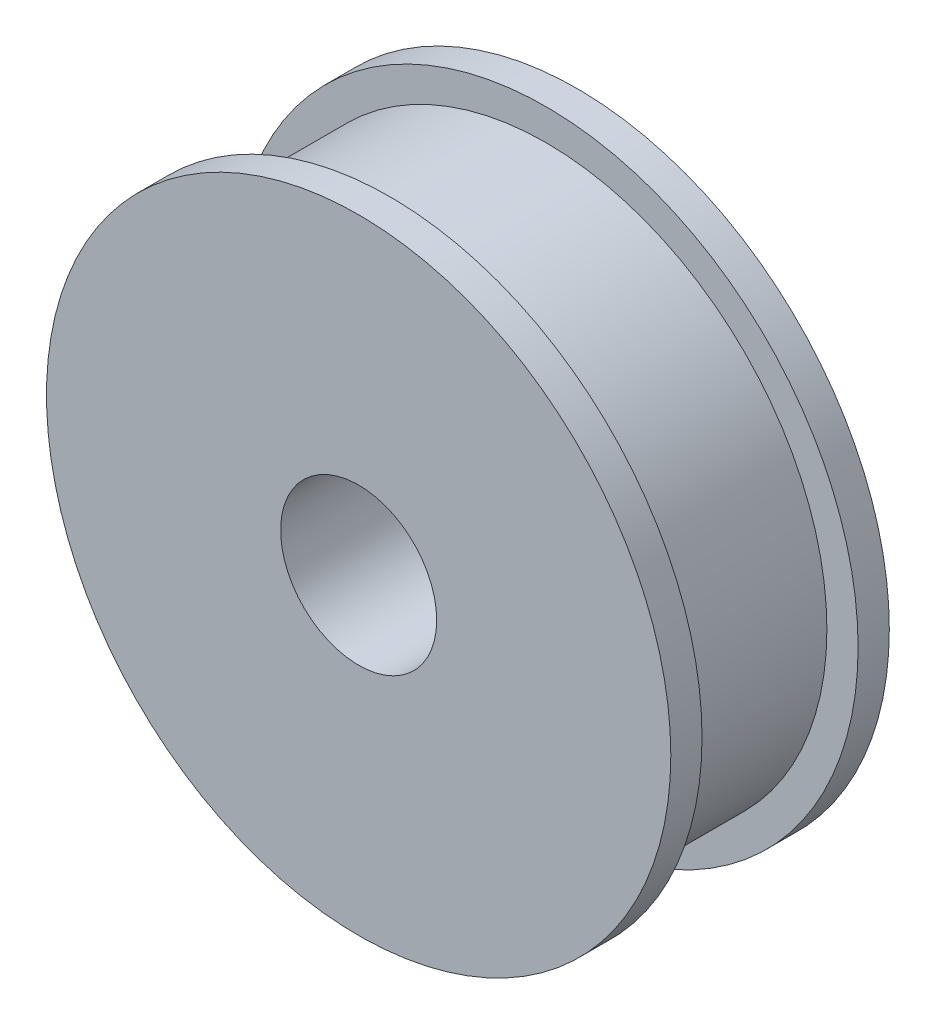
from build123d import *

# Parameters (mm, degrees)
SKETCH_2_R          = 20
EXTRUDE_1_DEPTH     = 2
SKETCH_3_R          = 18
EXTRUDE_2_DEPTH     = 10
SKETCH_4_R          = 20
EXTRUDE_3_DEPTH     = 2
SKETCH_5_R          = 5
CUT_EXTRUDE_1_DEPTH = 32.559467676


with BuildPart() as part:
    # ｽｹｯﾁ2 → ﾎﾞｽ - 押し出し1 (new body)
    with BuildSketch(Plane.XY):
        Circle(SKETCH_2_R)
    extrude(amount=EXTRUDE_1_DEPTH)

    # ｽｹｯﾁ3 → ﾎﾞｽ - 押し出し2 (add)
    with BuildSketch(Plane.XY.offset(2)):
        Circle(SKETCH_3_R)
    extrude(amount=EXTRUDE_2_DEPTH)

    # ｽｹｯﾁ4 → ﾎﾞｽ - 押し出し3 (add)
    with BuildSketch(Plane.XY.offset(12)):
        Circle(SKETCH_4_R)
    extrude(amount=EXTRUDE_3_DEPTH)

    # ｽｹｯﾁ5 → ｶｯﾄ - 押し出し1 (cut, through all)
    with BuildSketch(Plane.XY.offset(14)):
        Circle(SKETCH_5_R)
    extrude(amount=-CUT_EXTRUDE_1_DEPTH, mode=Mode.SUBTRACT)


solid = part.part
